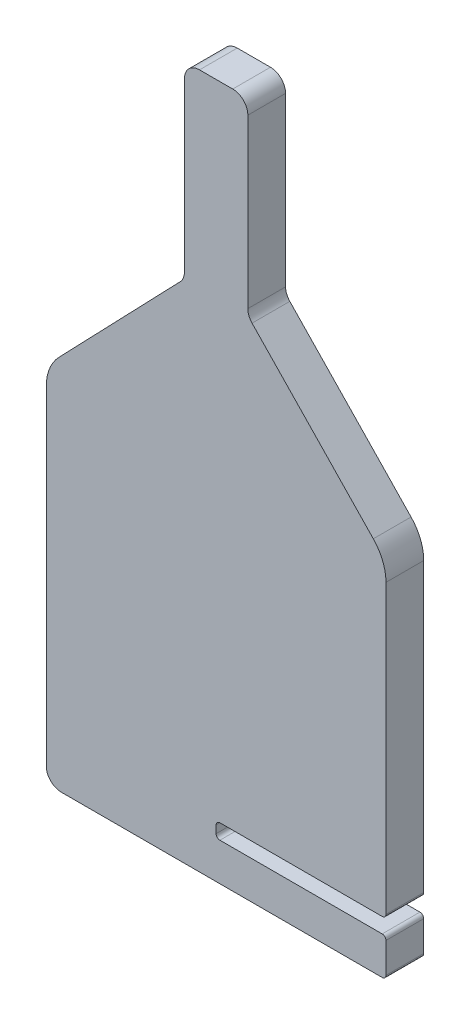
from build123d import *

# Parameters (mm, degrees)
SALIENTE_EXTRUIR1_DEPTH = 5
CROQUIS3_W              = 22.5
CROQUIS3_H              = 2
CORTAR_EXTRUIR2_DEPTH   = 5
REDONDEO1_R             = 2
REDONDEO2_R             = 6
REDONDEO3_R             = 0.5


with BuildPart() as part:
    # Croquis1 → Saliente-Extruir1 (new body)
    with BuildSketch(Plane.XY):
        Polygon((-4.2, 20), (-22.5, 0.971862939), (-22.5, -47.028137061), (22.5, -47.028137061), (22.5, 0.971862939), (4.2, 19.998997675), (4.2, 45), (-4.2, 45), align=None)
    extrude(amount=SALIENTE_EXTRUIR1_DEPTH)

    # Croquis3 → Cortar-Extruir2 (cut)
    with BuildSketch(Plane.XY.offset(5)):
        with Locations((11.25, -41.028137061)):
            Rectangle(CROQUIS3_W, CROQUIS3_H)
    extrude(amount=-CORTAR_EXTRUIR2_DEPTH, mode=Mode.SUBTRACT)

    # Redondeo1
    redondeo1_edges = [part.edges().sort_by_distance(p)[0] for p in [
        (-4.2, 45, 2.5),
        (-4.2, 20, 2.5),
        (-22.5, -47.028137061, 2.5),
        (4.2, 19.998997675, 2.5),
        (4.2, 45, 2.5),
    ]]
    fillet(redondeo1_edges, radius=REDONDEO1_R)

    # Redondeo2
    redondeo2_edges = [part.edges().sort_by_distance(p)[0] for p in [
        (-22.5, 0.971862939, 2.5),
        (22.5, 0.971862939, 2.5),
    ]]
    fillet(redondeo2_edges, radius=REDONDEO2_R)

    # Redondeo3
    redondeo3_edges = [part.edges().sort_by_distance(p)[0] for p in [
        (22.5, -47.028137061, 2.5),
        (0, -40.028137061, 2.5),
        (0, -42.028137061, 2.5),
        (22.5, -42.028137061, 2.5),
        (22.5, -40.028137061, 2.5),
    ]]
    fillet(redondeo3_edges, radius=REDONDEO3_R)


solid = part.part
